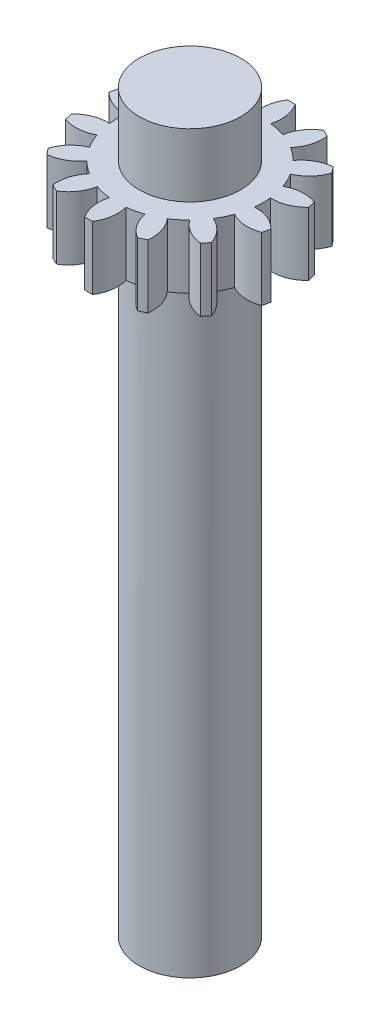
from build123d import *

# Parameters (mm, degrees)
SKETCH1_R                = 0.4
BOSS_EXTRUDE1_DEPTH      = 5
BOSS_EXTRUDE2_DEPTH      = 48
BOSS_EXTRUDE2_DEPTH_BACK = 5
SKETCH2_R                = 4
BOSS_EXTRUDE3_START      = 5
SKETCH3_R                = 4
BOSS_EXTRUDE3_DEPTH      = 5
CUT_EXTRUDE1_DEPTH       = 48


with BuildPart() as part:
    # Sketch1 → Boss-Extrude1 (new body)
    with BuildSketch(Plane(origin=(0, 0, 0), x_dir=(1, 0, 0), z_dir=(0, 1, 0))):
        with BuildLine():
            ThreePointArc((3.744900382, -7.069350828), (3.64692573, -5.891768521), (3.071904032, -4.859465672))
            ThreePointArc((3.071904032, -4.859465672), (3.584442871, -4.494749193), (4.054065768, -4.076217824))
            ThreePointArc((4.054065768, -4.076217824), (4.932532263, -4.866531521), (6.058788713, -5.224086459))
            ThreePointArc((6.058788713, -5.224086459), (6.25465186, -4.987918415), (6.441315028, -4.744413632))
            ThreePointArc((6.441315028, -4.744413632), (5.842109102, -3.725958242), (4.876133034, -3.045378078))
            ThreePointArc((4.876133034, -3.045378078), (5.179670022, -2.494397616), (5.421191676, -1.913552144))
            ThreePointArc((5.421191676, -1.913552144), (6.555566902, -2.244447854), (7.725426174, -2.077929362))
            ThreePointArc((7.725426174, -2.077929362), (7.799423297, -1.780167472), (7.861948235, -1.47978713))
            ThreePointArc((7.861948235, -1.47978713), (6.880191117, -0.822176238), (5.714584087, -0.628116006))
            ThreePointArc((5.714584087, -0.628116006), (5.749, 0), (5.714584087, 0.628116006))
            ThreePointArc((5.714584087, 0.628116006), (6.880191117, 0.822176238), (7.861948235, 1.47978713))
            ThreePointArc((7.861948235, 1.47978713), (7.799423297, 1.780167472), (7.725426174, 2.077929362))
            ThreePointArc((7.725426174, 2.077929362), (6.555566902, 2.244447854), (5.421191676, 1.913552144))
            ThreePointArc((5.421191676, 1.913552144), (5.179670022, 2.494397616), (4.876133034, 3.045378078))
            ThreePointArc((4.876133034, 3.045378078), (5.842109102, 3.725958242), (6.441315028, 4.744413632))
            ThreePointArc((6.441315028, 4.744413632), (6.25465186, 4.987918415), (6.058788713, 5.224086459))
            ThreePointArc((6.058788713, 5.224086459), (4.932532263, 4.866531521), (4.054065768, 4.076217824))
            ThreePointArc((4.054065768, 4.076217824), (3.584442871, 4.494749193), (3.071904032, 4.859465672))
            ThreePointArc((3.071904032, 4.859465672), (3.64692573, 5.891768521), (3.744900382, 7.069350828))
            ThreePointArc((3.744900382, 7.069350828), (3.471069913, 7.207750943), (3.192133841, 7.335549164))
            ThreePointArc((3.192133841, 7.335549164), (2.332549116, 6.524738937), (1.883982415, 5.431538572))
            ThreePointArc((1.883982415, 5.431538572), (1.279272849, 5.604860567), (0.659246762, 5.711076493))
            ThreePointArc((0.659246762, 5.711076493), (0.72942399, 6.890641786), (0.306762287, 7.994116393))
            ThreePointArc((0.306762287, 7.994116393), (0, 8), (-0.306762287, 7.994116393))
            ThreePointArc((-0.306762287, 7.994116393), (-0.72942399, 6.890641786), (-0.659246762, 5.711076493))
            ThreePointArc((-0.659246762, 5.711076493), (-1.279272849, 5.604860567), (-1.883982415, 5.431538572))
            ThreePointArc((-1.883982415, 5.431538572), (-2.332549116, 6.524738937), (-3.192133841, 7.335549164))
            ThreePointArc((-3.192133841, 7.335549164), (-3.471069913, 7.207750943), (-3.744900382, 7.069350828))
            ThreePointArc((-3.744900382, 7.069350828), (-3.64692573, 5.891768521), (-3.071904032, 4.859465672))
            ThreePointArc((-3.071904032, 4.859465672), (-3.584442871, 4.494749193), (-4.054065768, 4.076217824))
            ThreePointArc((-4.054065768, 4.076217824), (-4.932532263, 4.866531521), (-6.058788713, 5.224086459))
            ThreePointArc((-6.058788713, 5.224086459), (-6.25465186, 4.987918415), (-6.441315028, 4.744413632))
            ThreePointArc((-6.441315028, 4.744413632), (-5.842109102, 3.725958242), (-4.876133034, 3.045378078))
            ThreePointArc((-4.876133034, 3.045378078), (-5.179670022, 2.494397616), (-5.421191676, 1.913552144))
            ThreePointArc((-5.421191676, 1.913552144), (-6.555566902, 2.244447854), (-7.725426174, 2.077929362))
            ThreePointArc((-7.725426174, 2.077929362), (-7.799423297, 1.780167472), (-7.861948235, 1.47978713))
            ThreePointArc((-7.861948235, 1.47978713), (-6.880191117, 0.822176238), (-5.714584087, 0.628116006))
            ThreePointArc((-5.714584087, 0.628116006), (-5.749, 0), (-5.714584087, -0.628116006))
            ThreePointArc((-5.714584087, -0.628116006), (-6.880191117, -0.822176238), (-7.861948235, -1.47978713))
            ThreePointArc((-7.861948235, -1.47978713), (-7.799423297, -1.780167472), (-7.725426174, -2.077929362))
            ThreePointArc((-7.725426174, -2.077929362), (-6.555566902, -2.244447854), (-5.421191676, -1.913552144))
            ThreePointArc((-5.421191676, -1.913552144), (-5.179670022, -2.494397616), (-4.876133034, -3.045378078))
            ThreePointArc((-4.876133034, -3.045378078), (-5.842109102, -3.725958242), (-6.441315028, -4.744413632))
            ThreePointArc((-6.441315028, -4.744413632), (-6.25465186, -4.987918415), (-6.058788713, -5.224086459))
            ThreePointArc((-6.058788713, -5.224086459), (-4.932532263, -4.866531521), (-4.054065768, -4.076217824))
            ThreePointArc((-4.054065768, -4.076217824), (-3.584442871, -4.494749193), (-3.071904032, -4.859465672))
            ThreePointArc((-3.071904032, -4.859465672), (-3.64692573, -5.891768521), (-3.744900382, -7.069350828))
            ThreePointArc((-3.744900382, -7.069350828), (-3.471069913, -7.207750943), (-3.192133841, -7.335549164))
            ThreePointArc((-3.192133841, -7.335549164), (-2.332549116, -6.524738937), (-1.883982415, -5.431538572))
            ThreePointArc((-1.883982415, -5.431538572), (-1.279272849, -5.604860567), (-0.659246762, -5.711076493))
            ThreePointArc((-0.659246762, -5.711076493), (-0.72942399, -6.890641786), (-0.306762287, -7.994116393))
            ThreePointArc((-0.306762287, -7.994116393), (0, -8), (0.306762287, -7.994116393))
            ThreePointArc((0.306762287, -7.994116393), (0.72942399, -6.890641786), (0.659246762, -5.711076493))
            ThreePointArc((0.659246762, -5.711076493), (1.279272849, -5.604860567), (1.883982415, -5.431538572))
            ThreePointArc((1.883982415, -5.431538572), (2.332549116, -6.524738937), (3.192133841, -7.335549164))
            ThreePointArc((3.192133841, -7.335549164), (3.471069913, -7.207750943), (3.744900382, -7.069350828))
        make_face()
        with Locations(Location((0, 0, 0), (0, 0, 90))):
            Circle(SKETCH1_R, mode=Mode.SUBTRACT)
    extrude(amount=-BOSS_EXTRUDE1_DEPTH)

    # Sketch2 → Boss-Extrude2 (add, two sides: drawn at the far end of the back side and taken through both)
    with BuildSketch(Plane.XZ.offset(5).offset(-BOSS_EXTRUDE2_DEPTH_BACK)):
        with Locations(Location((0, 0, 0), (0, 0, 270))):
            Circle(SKETCH2_R)
    extrude(amount=BOSS_EXTRUDE2_DEPTH + BOSS_EXTRUDE2_DEPTH_BACK)

    # Sketch3 → Boss-Extrude3 (add)
    with BuildSketch(Plane(origin=(0, 0, 0), x_dir=(1, 0, 0), z_dir=(0, 1, 0)).offset(BOSS_EXTRUDE3_START)):
        with Locations(Location((0, 0, 0), (0, 0, 90))):
            Circle(SKETCH3_R)
    extrude(amount=-BOSS_EXTRUDE3_DEPTH)

    # Sketch4 → Cut-Extrude1 (cut)
    with BuildSketch(Plane.XZ.offset(53)):
        with BuildLine():
            Line((-2, -1.5), (2, -1.5))
            ThreePointArc((2, -1.5), (2.5, 0), (2, 1.5))
            Line((2, 1.5), (-2, 1.5))
            ThreePointArc((-2, 1.5), (-2.5, 0), (-2, -1.5))
        make_face()
    extrude(amount=-CUT_EXTRUDE1_DEPTH, mode=Mode.SUBTRACT)


solid = part.part
